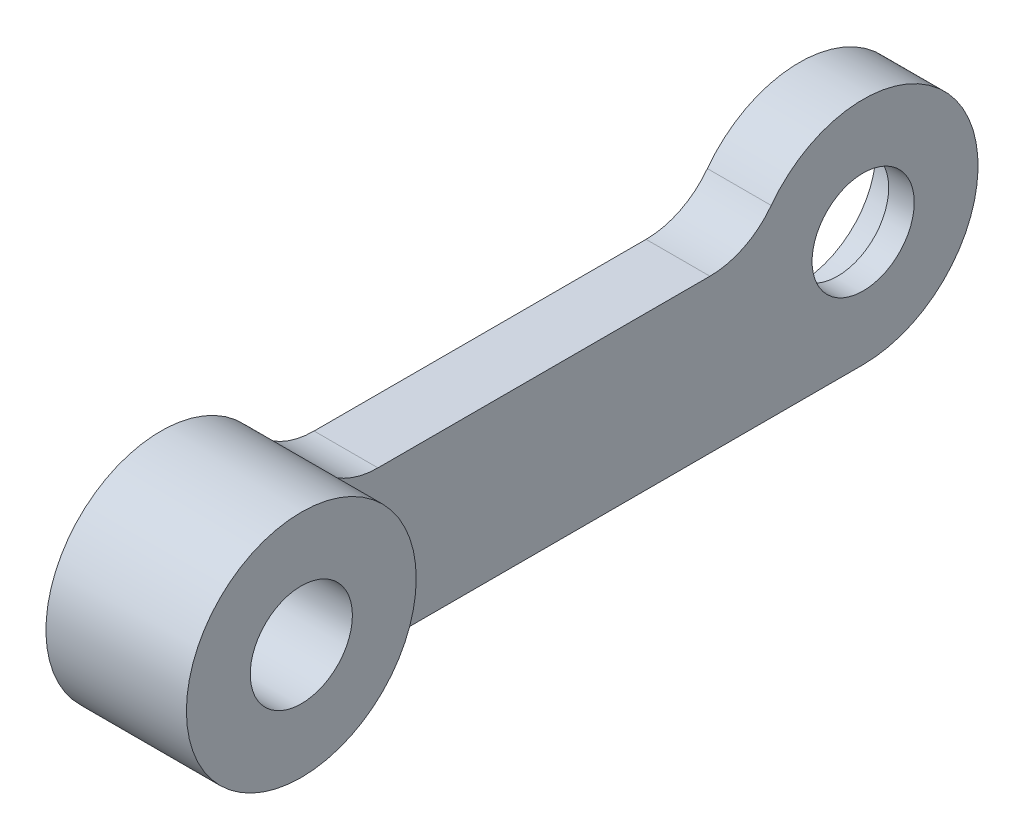
from build123d import *

# Parameters (mm, degrees)
SKETCH_1_R               = 4.5
SKETCH_1_W               = 25
SKETCH_1_H               = 6
EXTRUDE_1_DEPTH          = 2.5
EXTRUDE_START            = -3
SKETCH_1_5_R             = 4.5
EXTRUDE_3_DEPTH          = 3
CUT_EXTRUDE_2_DEPTH      = 31.253099015
CUT_EXTRUDE_2_DEPTH_BACK = 31.253099015
SKETCH_1_4_R             = 2
FILLET_1_R               = 3
SKETCH_2_R               = 3
CUT_EXTRUDE_3_DEPTH      = 1.5
SKETCH_3_W               = 41.902473513
SKETCH_3_H               = 17.131219194
CUT_EXTRUDE_4_DEPTH      = 31.797727189


with BuildPart() as part:
    # 草图1 → 凸台-拉伸1 (new body)
    with BuildSketch(Plane(origin=(0, 0, 0), x_dir=(0, 0, -1), z_dir=(1, 0, 0))):
        with Locations((0, -1.5)):
            Circle(SKETCH_1_R)
        with Locations((25, -1.5)):
            Circle(SKETCH_1_R)
        with Locations((12.5, -3)):
            Rectangle(SKETCH_1_W, SKETCH_1_H)
    extrude(amount=EXTRUDE_1_DEPTH)

    # 草图1<5> → 凸台-拉伸3 (add)
    with BuildSketch(Plane(origin=(0, 0, 0), x_dir=(0, 0, -1), z_dir=(1, 0, 0)).offset(EXTRUDE_START)):
        with Locations((0, -1.5)):
            Circle(SKETCH_1_5_R)
    extrude(amount=EXTRUDE_3_DEPTH)

    # 草图1<4> → 切除-拉伸2 (cut, two sides: drawn at the far end of the back side and taken through both)
    with BuildSketch(Plane(origin=(0, 0, 0), x_dir=(0, 0, -1), z_dir=(1, 0, 0)).offset(-CUT_EXTRUDE_2_DEPTH_BACK)):
        with Locations((0, -1.5)):
            Circle(SKETCH_1_4_R)
        with Locations((25, -1.5)):
            Circle(SKETCH_1_4_R)
    extrude(amount=CUT_EXTRUDE_2_DEPTH + CUT_EXTRUDE_2_DEPTH_BACK, mode=Mode.SUBTRACT)

    # 圆角1
    fillet_1_edges = [part.edges().sort_by_distance(p)[0] for p in [
        (1.25, 0, -20.757359313),
        (1.25, 0, -4.242640687),
    ]]
    fillet(fillet_1_edges, radius=FILLET_1_R)

    # 草图2 → 切除-拉伸3 (cut)
    with BuildSketch(Plane(origin=(2.5, 0, 0), x_dir=(0, 0, -1), z_dir=(1, 0, 0))):
        with Locations((0, -1.5)):
            Circle(SKETCH_2_R)
        with Locations((25, -1.5)):
            Circle(SKETCH_2_R)
    extrude(amount=-CUT_EXTRUDE_3_DEPTH, mode=Mode.SUBTRACT)


with BuildPart() as body_2:
    # 镜向2: mirrored copy
    add(part.part.mirror(Plane(origin=(3.5, 0, 0), x_dir=(0, 0, 1), z_dir=(1, 0, 0))))


with BuildPart() as part_1:
    add(part.part)

    # 草图3 → 切除-拉伸4 (cut, through all)
    with BuildSketch(Plane(origin=(3.5, 0, 0), x_dir=(0, 0, -1), z_dir=(1, 0, 0))):
        with Locations((12.668553329, -1.632419341)):
            Rectangle(SKETCH_3_W, SKETCH_3_H)
    extrude(amount=-CUT_EXTRUDE_4_DEPTH, mode=Mode.SUBTRACT)


solid = body_2.part
